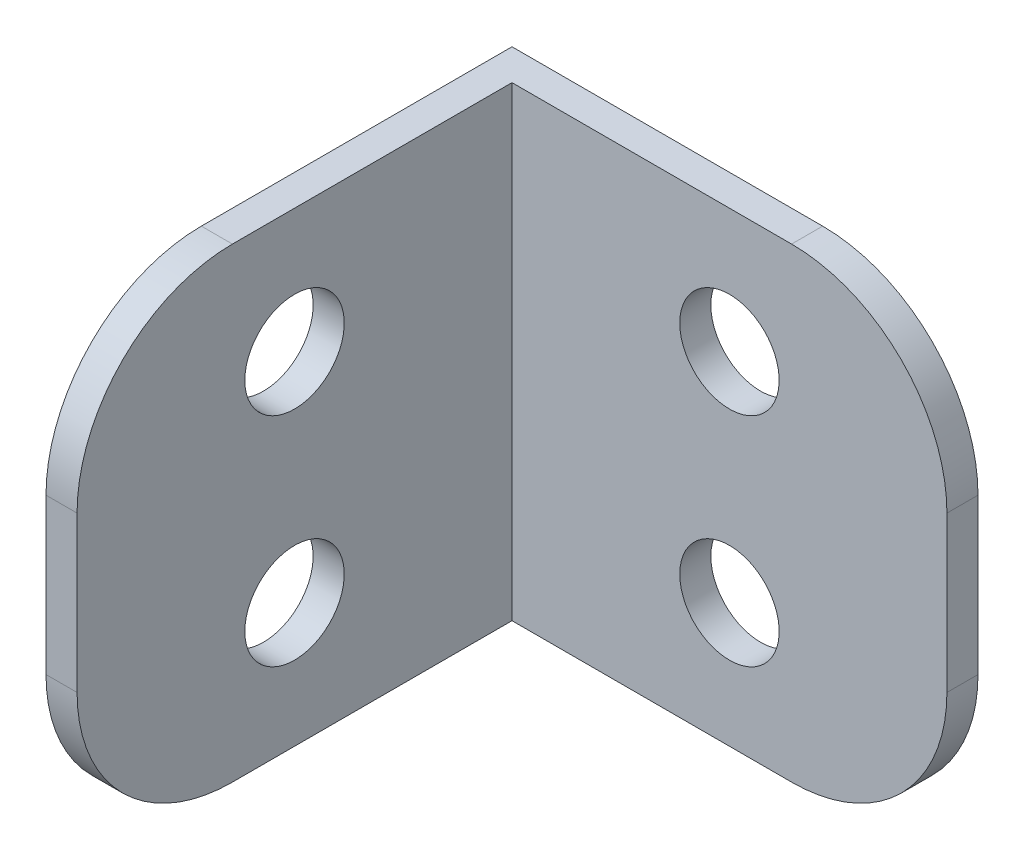
from build123d import *

# Parameters (mm, degrees)
EXTRUDE_1_DEPTH     = 15
FILLET_1_R          = 5
SKETCH_2_R          = 1.6
CUT_EXTRUDE_1_DEPTH = 15
SKETCH_3_R          = 1.6
CUT_EXTRUDE_2_DEPTH = 15


with BuildPart() as part:
    # 草图1 → 凸台-拉伸1 (new body)
    with BuildSketch(Plane(origin=(0, 0, 0), x_dir=(1, 0, 0), z_dir=(0, 1, 0))):
        Polygon((0, 0), (-15, 0), (-15, -15), (-14, -15), (-14, -1), (0, -1), align=None)
    extrude(amount=EXTRUDE_1_DEPTH)

    # 圆角1
    fillet_1_edges = [part.edges().sort_by_distance(p)[0] for p in [
        (-14.5, 15, 15),
        (0, 15, 0.5),
        (-14.5, 0, 15),
        (0, 0, 0.5),
    ]]
    fillet(fillet_1_edges, radius=FILLET_1_R)

    # 草图2 → 切除-拉伸1 (cut)
    with BuildSketch(Plane(origin=(0, 0, 0), x_dir=(-1, 0, 0), z_dir=(0, 0, -1))):
        with Locations((7, 11)):
            Circle(SKETCH_2_R)
        with Locations((7, 4)):
            Circle(SKETCH_2_R)
    extrude(amount=-CUT_EXTRUDE_1_DEPTH, mode=Mode.SUBTRACT)

    # 草图3 → 切除-拉伸2 (cut)
    with BuildSketch(Plane.ZY.offset(15)):
        with Locations((8, 11)):
            Circle(SKETCH_3_R)
        with Locations((8, 4)):
            Circle(SKETCH_3_R)
    extrude(amount=-CUT_EXTRUDE_2_DEPTH, mode=Mode.SUBTRACT)


solid = part.part
